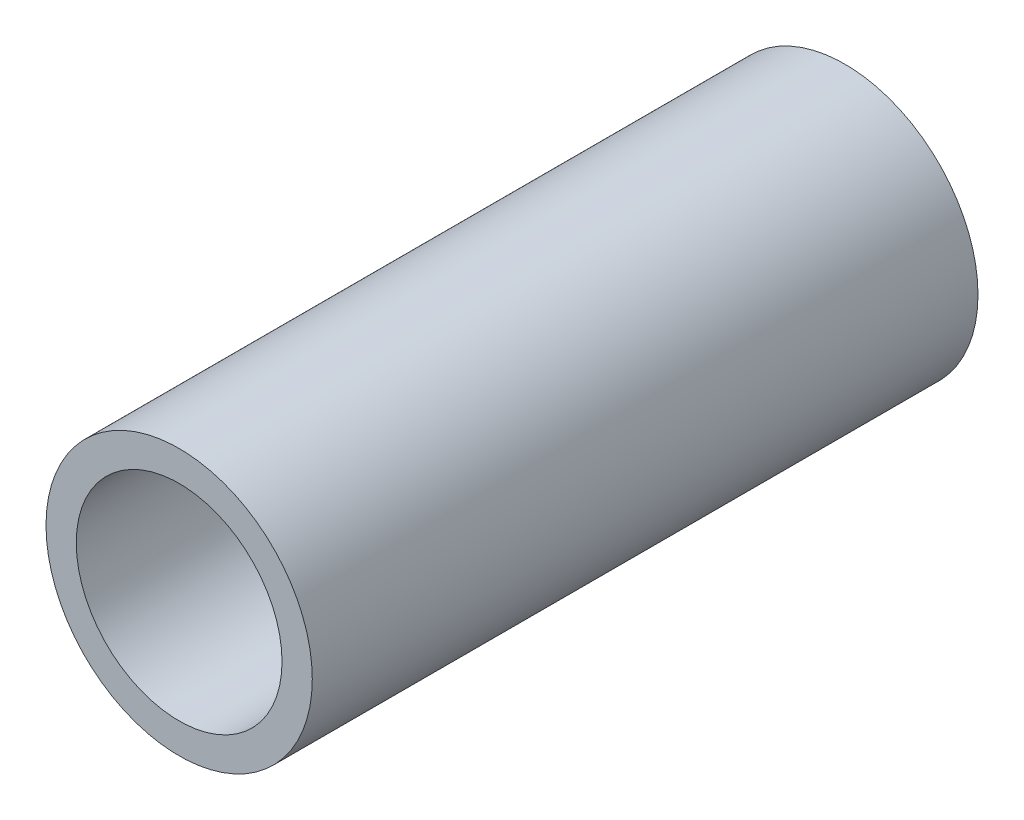
from build123d import *

# Parameters (mm, degrees)
SKETCH1_R           = 2.2
SKETCH1_R_2         = 1.7
BOSS_EXTRUDE1_DEPTH = 11


with BuildPart() as part:
    # Sketch1 → Boss-Extrude1 (new body)
    with BuildSketch(Plane.XY):
        Circle(SKETCH1_R)
        Circle(SKETCH1_R_2, mode=Mode.SUBTRACT)
    extrude(amount=BOSS_EXTRUDE1_DEPTH)


solid = part.part
